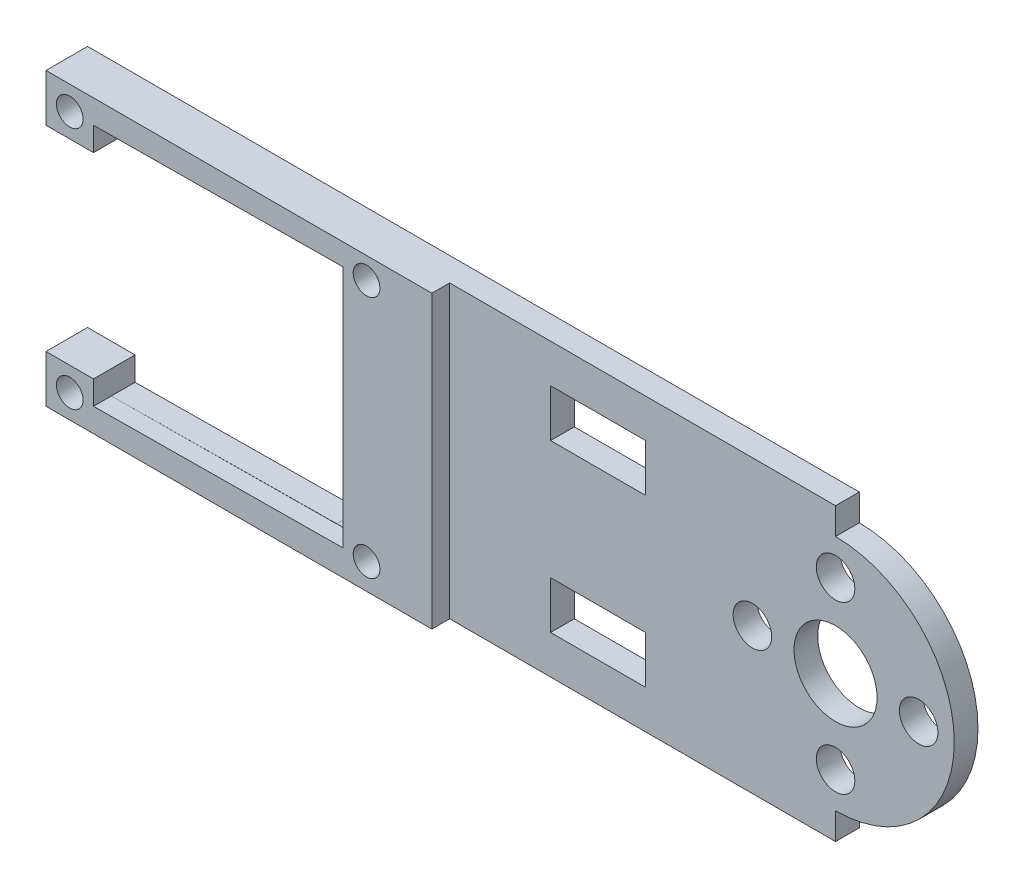
from build123d import *

# Parameters (mm, degrees)
SKETCH1_R           = 1.625
SKETCH1_R_2         = 3.5
SKETCH1_R_3         = 1.125
SKETCH1_W           = 8
SKETCH1_H           = 4
BOSS_EXTRUDE1_DEPTH = 2
SKETCH8_R           = 1.125
BOSS_EXTRUDE4_DEPTH = 1.5


with BuildPart() as part:
    # Sketch1 → Boss-Extrude1 (new body)
    with BuildSketch(Plane.XY):
        with BuildLine():
            Line((-27, -8.25), (-27, -12.25))
            Line((-27, -12.25), (38, -12.25))
            Line((38, -12.25), (38, -10))
            ThreePointArc((38, -10), (48, 0), (38, 10))
            Line((38, 10), (38, 12.25))
            Line((38, 12.25), (-27, 12.25))
            Line((-27, 12.25), (-27, 8.25))
            Line((-27, 8.25), (-23, 8.25))
            Line((-23, 8.25), (-23, 10.25))
            Line((-23, 10.25), (-4.001411983, 10.429151381))
            Line((-4.001411983, 10.429151381), (-2, 10.429151381))
            Line((-2, 10.429151381), (-2, -10.070848619))
            Line((-2, -10.070848619), (-4.001411983, -10.070848619))
            Line((-4.001411983, -10.070848619), (-23, -10.25))
            Line((-23, -10.25), (-23, -8.25))
            Line((-23, -8.25), (-27, -8.25))
        make_face()
        with Locations((38, 7)):
            Circle(SKETCH1_R, mode=Mode.SUBTRACT)
        with Locations((45, 0)):
            Circle(SKETCH1_R, mode=Mode.SUBTRACT)
        with Locations((38, -7)):
            Circle(SKETCH1_R, mode=Mode.SUBTRACT)
        with Locations((31, 0)):
            Circle(SKETCH1_R, mode=Mode.SUBTRACT)
        with Locations((38, 0)):
            Circle(SKETCH1_R_2, mode=Mode.SUBTRACT)
        with Locations((-25, 10.25)):
            Circle(SKETCH1_R_3, mode=Mode.SUBTRACT)
        with Locations((-25, -10.25)):
            Circle(SKETCH1_R_3, mode=Mode.SUBTRACT)
        with Locations((0, 10.429151381)):
            Circle(SKETCH1_R_3, mode=Mode.SUBTRACT)
        with Locations((0, -10.070848619)):
            Circle(SKETCH1_R_3, mode=Mode.SUBTRACT)
        with Locations((18, 7)):
            Rectangle(SKETCH1_W, SKETCH1_H, mode=Mode.SUBTRACT)
        with Locations((18, -7)):
            Rectangle(SKETCH1_W, SKETCH1_H, mode=Mode.SUBTRACT)
    extrude(amount=BOSS_EXTRUDE1_DEPTH)

    # Sketch8 → Boss-Extrude4 (add)
    with BuildSketch(Plane.XY.offset(2)):
        Polygon((-27, 12.25), (5.5, 12.25), (5.5, -12.25), (-27, -12.25), (-27, -8.25), (-23, -8.25), (-23, -10.25), (-2, -10.070848619), (-2, 10.429151381), (-23, 10.25), (-23, 8.25), (-27, 8.25), align=None)
        with Locations((-25, 10.25)):
            Circle(SKETCH8_R, mode=Mode.SUBTRACT)
        with Locations((-25, -10.25)):
            Circle(SKETCH8_R, mode=Mode.SUBTRACT)
        with Locations((0, 10.429151381)):
            Circle(SKETCH8_R, mode=Mode.SUBTRACT)
        with Locations((0, -10.070848619)):
            Circle(SKETCH8_R, mode=Mode.SUBTRACT)
    extrude(amount=BOSS_EXTRUDE4_DEPTH)


solid = part.part
